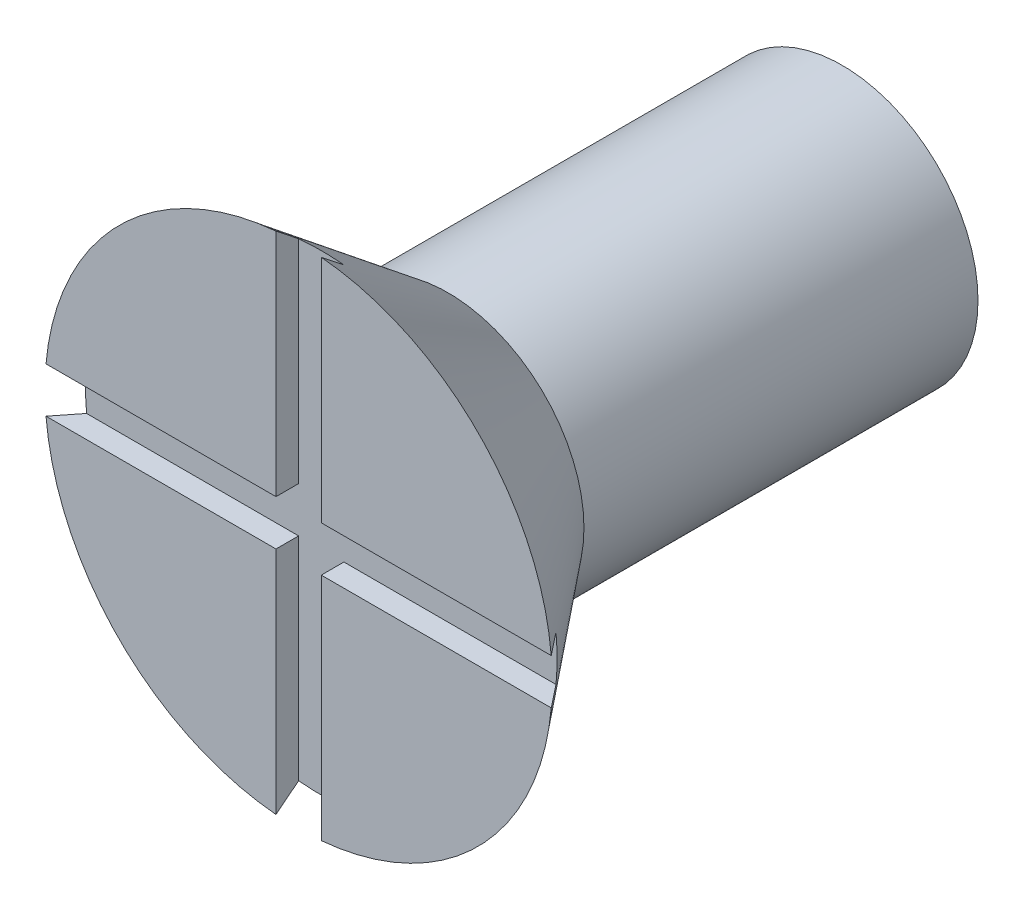
from build123d import *

# Parameters (mm, degrees)
CUT_EXTRUDE1_DEPTH = 0.25


with BuildPart() as part:
    # Sketch2 → Revolve1 (revolve)
    with BuildSketch(Plane(origin=(0, 0, 0), x_dir=(0, 0, -1), z_dir=(1, 0, 0)), mode=Mode.PRIVATE) as revolve1_sk:
        Polygon((0, 0), (0, 2.8), (1.65, 1.5), (6, 1.5), (6, 0), align=None)
    revolve(revolve1_sk.sketch.rotate(Axis((0, 0, 0), (0, 0, -1)), 90), axis=Axis((0, 0, 0), (0, 0, -1)))

    # Sketch3 → Cut-Extrude1 (cut)
    with BuildSketch(Plane.XY):
        Polygon((-0.25, 2.8), (-0.25, 0.25), (-2.8, 0.25), (-3.256058343, -0.027319636), (-2.8, -0.25), (-0.25, -0.25), (-0.25, -2.8), (0.125, -3.416695886), (0.25, -2.8), (0.25, -0.25), (2.8, -0.25), (3.211130591, 0), (2.8, 0.25), (0.25, 0.25), (0.25, 2.8), (0, 3.10316335), align=None)
    extrude(amount=-CUT_EXTRUDE1_DEPTH, mode=Mode.SUBTRACT)


solid = part.part
